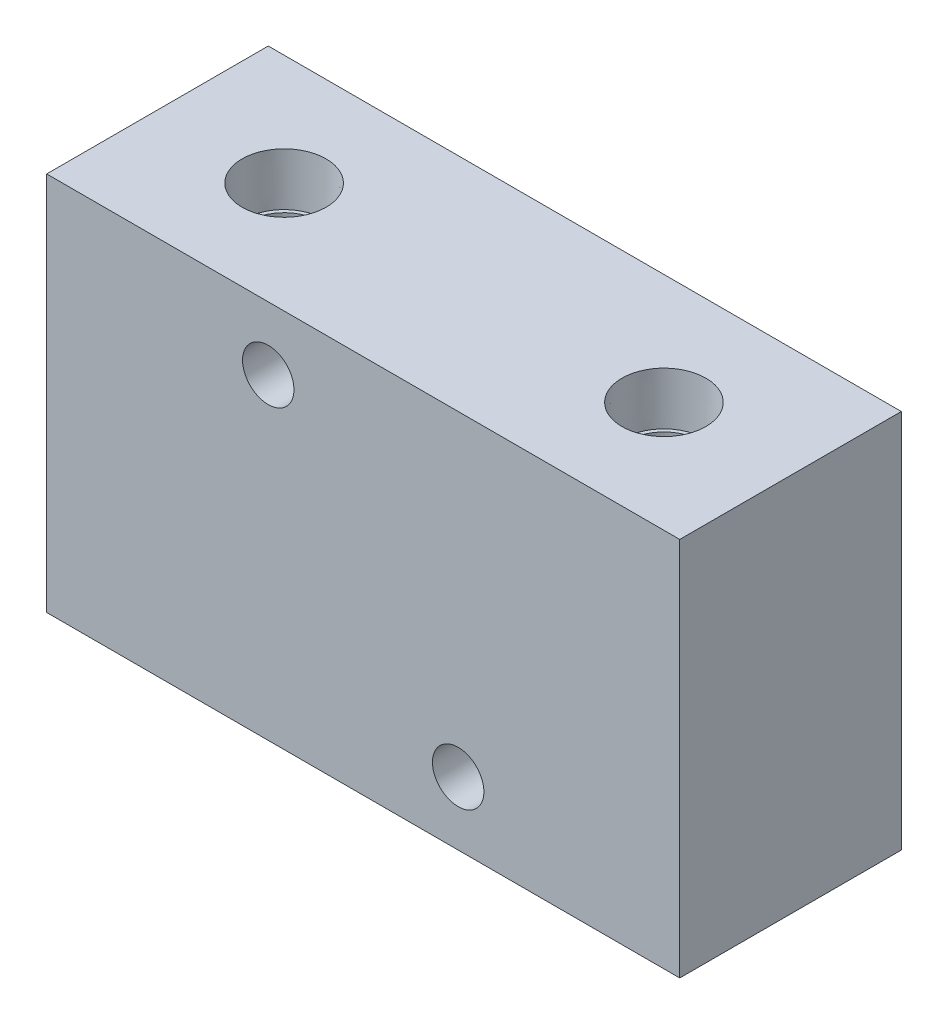
from build123d import *

# Parameters (mm, degrees)
SKETCH1_W                = 127
SKETCH1_H                = 76.2
BASE_EXTRUDE_DEPTH       = 44.45
SKETCH13_R               = 10.47242
CUT_EXTRUDE7_DEPTH       = 13.57122
CUT_EXTRUDE7_DRAFT       = -1.783333333
SKETCH14_R               = 8.9281
CUT_EXTRUDE8_DEPTH       = 114.3
SKETCH17_R               = 8.41883
CUT_EXTRUDE10_DEPTH      = 10.33018
CUT_EXTRUDE10_DRAFT      = -1.783333333
CUT_EXTRUDE11_REACH      = 182.583
CUT_EXTRUDE11_END_RADIUS = 8.9281
SKETCH18_R               = 7.3406
SKETCH21_R               = 8.41883
CUT_EXTRUDE13_DEPTH      = 10.33018
CUT_EXTRUDE13_DRAFT      = -1.783333333
CUT_EXTRUDE14_REACH      = 151.643
CUT_EXTRUDE14_END_RADIUS = 8.9281
SKETCH22_R               = 7.3406
SKETCH25_R               = 8.41883
CUT_EXTRUDE16_DEPTH      = 10.3378
CUT_EXTRUDE16_DRAFT      = -1.783333333
CUT_EXTRUDE17_REACH      = 124.053
CUT_EXTRUDE17_END_RADIUS = 8.9281
SKETCH26_R               = 7.3406
MIRROR1_COPY_1_SKETCH_R  = 8.41883
MIRROR1_COPY_1_DEPTH     = 10.33018
MIRROR1_COPY_1_DRAFT     = -1.783333333
MIRROR1_COPY_2_SKETCH_R  = 8.41883
MIRROR1_COPY_2_DEPTH     = 10.3378
MIRROR1_COPY_2_DRAFT     = -1.783333333
SKETCH29_R               = 5.1562
CUT_EXTRUDE19_DEPTH      = 87.36933773


with BuildPart() as part:
    # Sketch1 → Base-Extrude (new body)
    with BuildSketch(Plane.XY):
        Rectangle(SKETCH1_W, SKETCH1_H)
    extrude(amount=BASE_EXTRUDE_DEPTH)


with BuildPart() as cut_extrude7_tool:
    # Sketch13 → Cut-Extrude7 (with draft: the straight prism first)
    with BuildSketch(Plane(origin=(-63.5, 42.382338567, -29.074180248), x_dir=(0, 0, 1), z_dir=(-1, 0, 0))):
        with Locations((51.173800102, -42.382338567)):
            Circle(SKETCH13_R)
    extrude(amount=-CUT_EXTRUDE7_DEPTH)
    # Cut-Extrude7: the draft: its side faces are tilted about the plane it starts from
    cut_extrude7_sides = [cut_extrude7_tool.faces().sort_by_distance(p)[0] for p in [
        (-56.71439, 0, 11.627199854),
    ]]
    draft(cut_extrude7_sides, Plane(origin=(-63.5, 42.382338567, -29.074180248), x_dir=(0, 0, 1), z_dir=(-1, 0, 0)), CUT_EXTRUDE7_DRAFT)


with BuildPart() as part_1:
    add(part.part)

    # Cut-Extrude7: cut by cut_extrude7_tool
    add(cut_extrude7_tool.part, mode=Mode.SUBTRACT)

    # Sketch14 → Cut-Extrude8 (cut)
    with BuildSketch(Plane(origin=(-63.5, 38.1, -63.5), x_dir=(0, 0, 1), z_dir=(-1, 0, 0))):
        with Locations((85.599619854, -38.1)):
            Circle(SKETCH14_R)
    extrude(amount=-CUT_EXTRUDE8_DEPTH, mode=Mode.SUBTRACT)

    # Cut-Extrude9 cone 1 section (through the dimple's axis) → Cut-Extrude9 (revolve, cut)
    with BuildSketch(Plane(origin=(50.8, 0, 22.099619854), x_dir=(0, 0, 1), z_dir=(0, 1, 0))):
        Polygon((0, 0), (8.9281, 0), (0, 5.154640938), align=None)
    revolve(axis=Axis((50.8, 0, 22.099619854), (1, 0, 0)), mode=Mode.SUBTRACT)


with BuildPart() as cut_extrude10_tool:
    # Sketch17 → Cut-Extrude10 (with draft: the straight prism first)
    with BuildSketch(Plane(origin=(97.86363054, -38.1, 25.99710819), x_dir=(1, 0, 0), z_dir=(0, -1, 0))):
        with Locations((-59.76363054, -3.77210819)):
            Circle(SKETCH17_R)
    extrude(amount=-CUT_EXTRUDE10_DEPTH)
    # Cut-Extrude10: the draft: its side faces are tilted about the plane it starts from
    cut_extrude10_sides = [cut_extrude10_tool.faces().sort_by_distance(p)[0] for p in [
        (29.68117, -32.93491, 22.225),
    ]]
    draft(cut_extrude10_sides, Plane(origin=(97.86363054, -38.1, 25.99710819), x_dir=(1, 0, 0), z_dir=(0, -1, 0)), CUT_EXTRUDE10_DRAFT)


with BuildPart() as part_2:
    add(part_1.part)

    # Cut-Extrude10: cut by cut_extrude10_tool
    add(cut_extrude10_tool.part, mode=Mode.SUBTRACT)

    # Cut-Extrude11: up to this cylinder (the profile starts outside it)
    cut_extrude11_end = Plane(origin=(38.1, 0, 22.099619854), z_dir=(-1, 0, 0)) * Cylinder(CUT_EXTRUDE11_END_RADIUS, 384.0222, mode=Mode.PRIVATE)
    # Sketch18 → Cut-Extrude11 (cut, up to the surface)
    with BuildSketch(Plane(origin=(98.70252821, -38.1, 22.225), x_dir=(1, 0, 0), z_dir=(0, -1, 0)), mode=Mode.PRIVATE) as cut_extrude11_sk1:
        with Locations(Location((-60.60252821, 0, 0), (0, 0, 270))):
            Circle(SKETCH18_R)
    cut_extrude11_tool1 = extrude(cut_extrude11_sk1.sketch, amount=-CUT_EXTRUDE11_REACH, mode=Mode.PRIVATE) - cut_extrude11_end
    cut_extrude11 = cut_extrude11_tool1.solids().sort_by_distance((38.1, -38.1, 22.225))[0]
    add(cut_extrude11, mode=Mode.SUBTRACT)


with BuildPart() as cut_extrude13_tool:
    # Sketch21 → Cut-Extrude13 (with draft: the straight prism first)
    with BuildSketch(Plane(origin=(60.495960608, -38.1, 35.437611041), x_dir=(1, 0, 0), z_dir=(0, -1, 0))):
        with Locations((-60.495960608, -13.212611041)):
            Circle(SKETCH21_R)
    extrude(amount=-CUT_EXTRUDE13_DEPTH)
    # Cut-Extrude13: the draft: its side faces are tilted about the plane it starts from
    cut_extrude13_sides = [cut_extrude13_tool.faces().sort_by_distance(p)[0] for p in [
        (-8.41883, -32.93491, 22.225),
    ]]
    draft(cut_extrude13_sides, Plane(origin=(60.495960608, -38.1, 35.437611041), x_dir=(1, 0, 0), z_dir=(0, -1, 0)), CUT_EXTRUDE13_DRAFT)


with BuildPart() as part_3:
    add(part_2.part)

    # Cut-Extrude13: cut by cut_extrude13_tool
    add(cut_extrude13_tool.part, mode=Mode.SUBTRACT)

    # Cut-Extrude14: up to this cylinder (the profile starts outside it)
    cut_extrude14_end = Plane(origin=(0, 0, 22.099619854), z_dir=(-1, 0, 0)) * Cylinder(CUT_EXTRUDE14_END_RADIUS, 322.1422, mode=Mode.PRIVATE)
    # Sketch22 → Cut-Extrude14 (cut, up to the surface)
    with BuildSketch(Plane(origin=(61.334858278, -38.1, 31.665502851), x_dir=(1, 0, 0), z_dir=(0, -1, 0)), mode=Mode.PRIVATE) as cut_extrude14_sk1:
        with Locations(Location((-61.334858278, -9.440502851, 0), (0, 0, 270))):
            Circle(SKETCH22_R)
    cut_extrude14_tool1 = extrude(cut_extrude14_sk1.sketch, amount=-CUT_EXTRUDE14_REACH, mode=Mode.PRIVATE) - cut_extrude14_end
    add(cut_extrude14_tool1.solids().sort_by_distance((0, -38.1, 22.225))[0], mode=Mode.SUBTRACT)


with BuildPart() as cut_extrude16_tool:
    # Sketch25 → Cut-Extrude16 (with draft: the straight prism first)
    with BuildSketch(Plane(origin=(25.307359991, -38.1, 36.236677515), x_dir=(1, 0, 0), z_dir=(0, -1, 0))):
        with Locations((-63.407359991, -14.011677515)):
            Circle(SKETCH25_R)
    extrude(amount=-CUT_EXTRUDE16_DEPTH)
    # Cut-Extrude16: the draft: its side faces are tilted about the plane it starts from
    cut_extrude16_sides = [cut_extrude16_tool.faces().sort_by_distance(p)[0] for p in [
        (-46.51883, -32.9311, 22.225),
    ]]
    draft(cut_extrude16_sides, Plane(origin=(25.307359991, -38.1, 36.236677515), x_dir=(1, 0, 0), z_dir=(0, -1, 0)), CUT_EXTRUDE16_DRAFT)


with BuildPart() as part_4:
    add(part_3.part)

    # Cut-Extrude16: cut by cut_extrude16_tool
    add(cut_extrude16_tool.part, mode=Mode.SUBTRACT)

    # Cut-Extrude17: up to this cylinder (the profile starts outside it)
    cut_extrude17_end = Plane(origin=(-38.1, 0, 22.099619854), z_dir=(-1, 0, 0)) * Cylinder(CUT_EXTRUDE17_END_RADIUS, 266.9622, mode=Mode.PRIVATE)
    # Sketch26 → Cut-Extrude17 (cut, up to the surface)
    with BuildSketch(Plane(origin=(26.146257661, -38.1, 32.464569325), x_dir=(1, 0, 0), z_dir=(0, -1, 0)), mode=Mode.PRIVATE) as cut_extrude17_sk1:
        with Locations(Location((-64.246257661, -10.239569325, 0), (0, 0, 270))):
            Circle(SKETCH26_R)
    cut_extrude17_tool1 = extrude(cut_extrude17_sk1.sketch, amount=-CUT_EXTRUDE17_REACH, mode=Mode.PRIVATE) - cut_extrude17_end
    cut_extrude17 = cut_extrude17_tool1.solids().sort_by_distance((-38.1, -38.1, 22.225))[0]
    add(cut_extrude17, mode=Mode.SUBTRACT)

    # Mirror1: Cut-Extrude11, Cut-Extrude17 across plane
    add(cut_extrude11.mirror(Plane.ZX), mode=Mode.SUBTRACT)
    add(cut_extrude17.mirror(Plane.ZX), mode=Mode.SUBTRACT)


with BuildPart() as mirror1_copy_1_tool:
    # Mirror1 copy 1 sketch → Mirror1 copy 1 (with draft: the straight prism first)
    with BuildSketch(Plane(origin=(97.86363054, 38.1, 25.99710819), x_dir=(1, 0, 0), z_dir=(0, 1, 0))):
        with Locations((-59.76363054, 3.77210819)):
            Circle(MIRROR1_COPY_1_SKETCH_R)
    extrude(amount=-MIRROR1_COPY_1_DEPTH)
    # Mirror1 copy 1: the draft: its side faces are tilted about the plane it starts from
    mirror1_copy_1_sides = [mirror1_copy_1_tool.faces().sort_by_distance(p)[0] for p in [
        (29.68117, 32.93491, 22.225),
    ]]
    draft(mirror1_copy_1_sides, Plane(origin=(97.86363054, 38.1, 25.99710819), x_dir=(1, 0, 0), z_dir=(0, 1, 0)), MIRROR1_COPY_1_DRAFT)


with BuildPart() as part_5:
    add(part_4.part)

    # Mirror1 copy 1: cut by mirror1_copy_1_tool
    add(mirror1_copy_1_tool.part, mode=Mode.SUBTRACT)


with BuildPart() as mirror1_copy_2_tool:
    # Mirror1 copy 2 sketch → Mirror1 copy 2 (with draft: the straight prism first)
    with BuildSketch(Plane(origin=(25.307359991, 38.1, 36.236677515), x_dir=(1, 0, 0), z_dir=(0, 1, 0))):
        with Locations((-63.407359991, 14.011677515)):
            Circle(MIRROR1_COPY_2_SKETCH_R)
    extrude(amount=-MIRROR1_COPY_2_DEPTH)
    # Mirror1 copy 2: the draft: its side faces are tilted about the plane it starts from
    mirror1_copy_2_sides = [mirror1_copy_2_tool.faces().sort_by_distance(p)[0] for p in [
        (-46.51883, 32.9311, 22.225),
    ]]
    draft(mirror1_copy_2_sides, Plane(origin=(25.307359991, 38.1, 36.236677515), x_dir=(1, 0, 0), z_dir=(0, 1, 0)), MIRROR1_COPY_2_DRAFT)


with BuildPart() as part_6:
    add(part_5.part)

    # Mirror1 copy 2: cut by mirror1_copy_2_tool
    add(mirror1_copy_2_tool.part, mode=Mode.SUBTRACT)

    # Sketch29 → Cut-Extrude19 (cut, through all)
    with BuildSketch(Plane(origin=(0, 0, 0), x_dir=(-1, 0, 0), z_dir=(0, 0, -1))):
        with Locations((-19.05, -25.4)):
            Circle(SKETCH29_R)
        with Locations((19.05, 25.4)):
            Circle(SKETCH29_R)
    extrude(amount=-CUT_EXTRUDE19_DEPTH, mode=Mode.SUBTRACT)


solid = part_6.part
